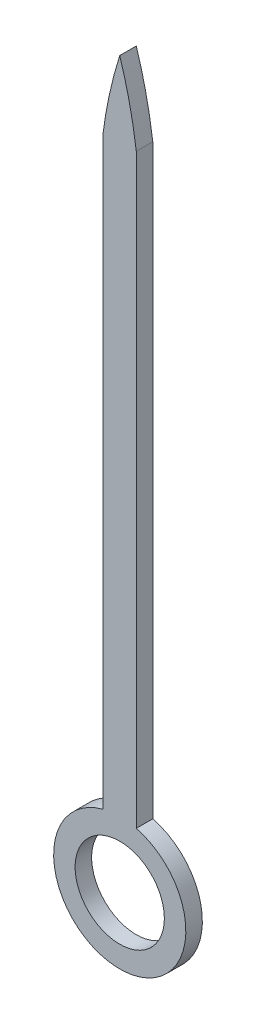
from build123d import *

# Parameters (mm, degrees)
SKETCH2_R           = 4.05
BOSS_EXTRUDE1_DEPTH = 1.5


with BuildPart() as part:
    # Sketch2 → Boss-Extrude1 (new body)
    with BuildSketch(Plane.XY):
        with BuildLine():
            Line((-1.5, 5.809475019), (-1.5, 59.037116847))
            add(Edge.make_bspline(
                [(0, 65.809475019), (-1.051472953, 62.487162114), (-1.5, 59.037116847)],
                knots=[0, 0, 0, 1, 1, 1], degree=2))
            add(Edge.make_bspline(
                [(0, 65.809475019), (1.051472953, 62.487162114), (1.5, 59.037116847)],
                knots=[0, 0, 0, 1, 1, 1], degree=2))
            Line((1.5, 59.037116847), (1.5, 5.809475019))
            ThreePointArc((1.5, 5.809475019), (0, -6), (-1.5, 5.809475019))
        make_face()
        Circle(SKETCH2_R, mode=Mode.SUBTRACT)
    extrude(amount=BOSS_EXTRUDE1_DEPTH)


solid = part.part
